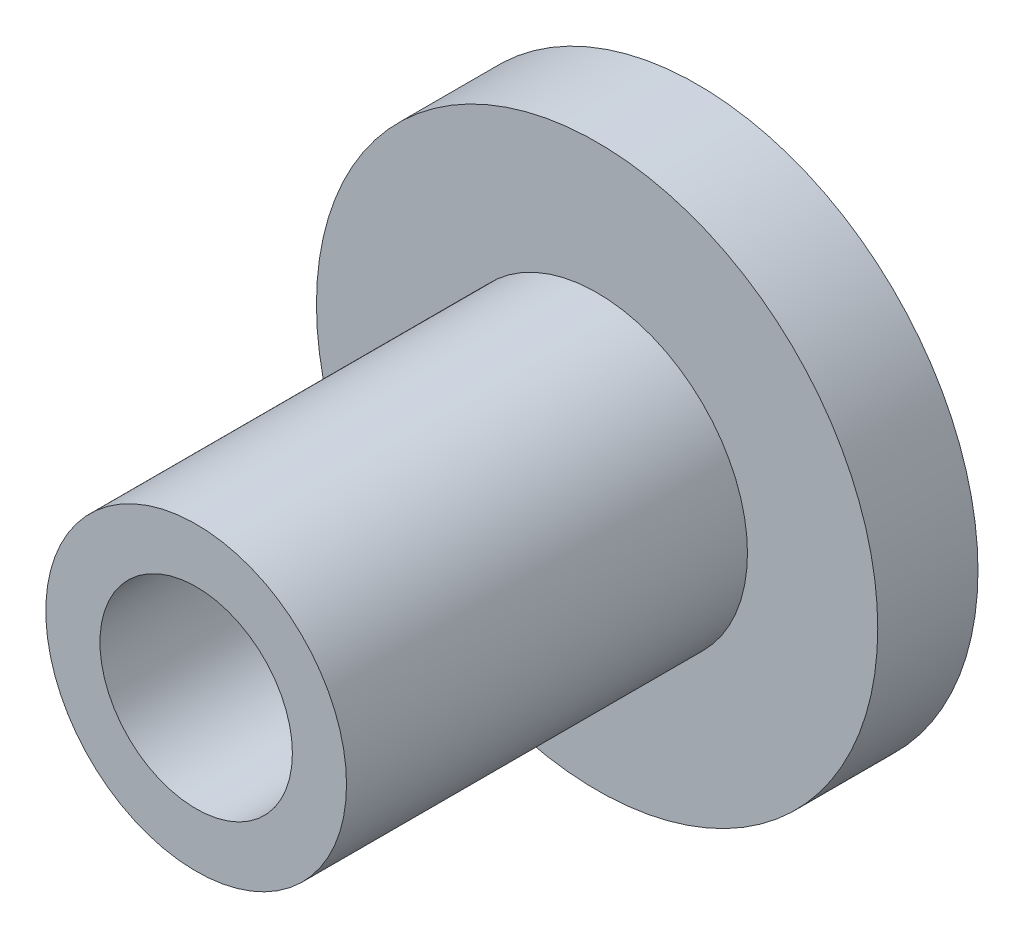
from build123d import *

# Parameters (mm, degrees)
SKETCH1_R           = 7
BOSS_EXTRUDE1_DEPTH = 2.5
SKETCH2_R           = 3.75
BOSS_EXTRUDE2_DEPTH = 10
SKETCH3_R           = 2.4
CUT_EXTRUDE1_DEPTH  = 5


with BuildPart() as part:
    # Sketch1 → Boss-Extrude1 (new body)
    with BuildSketch(Plane.XY):
        Circle(SKETCH1_R)
    extrude(amount=BOSS_EXTRUDE1_DEPTH)

    # Sketch2 → Boss-Extrude2 (add)
    with BuildSketch(Plane.XY.offset(2.5)):
        Circle(SKETCH2_R)
    extrude(amount=BOSS_EXTRUDE2_DEPTH)

    # Sketch3 → Cut-Extrude1 (cut)
    with BuildSketch(Plane.XY.offset(12.5)):
        Circle(SKETCH3_R)
    extrude(amount=-CUT_EXTRUDE1_DEPTH, mode=Mode.SUBTRACT)


solid = part.part
